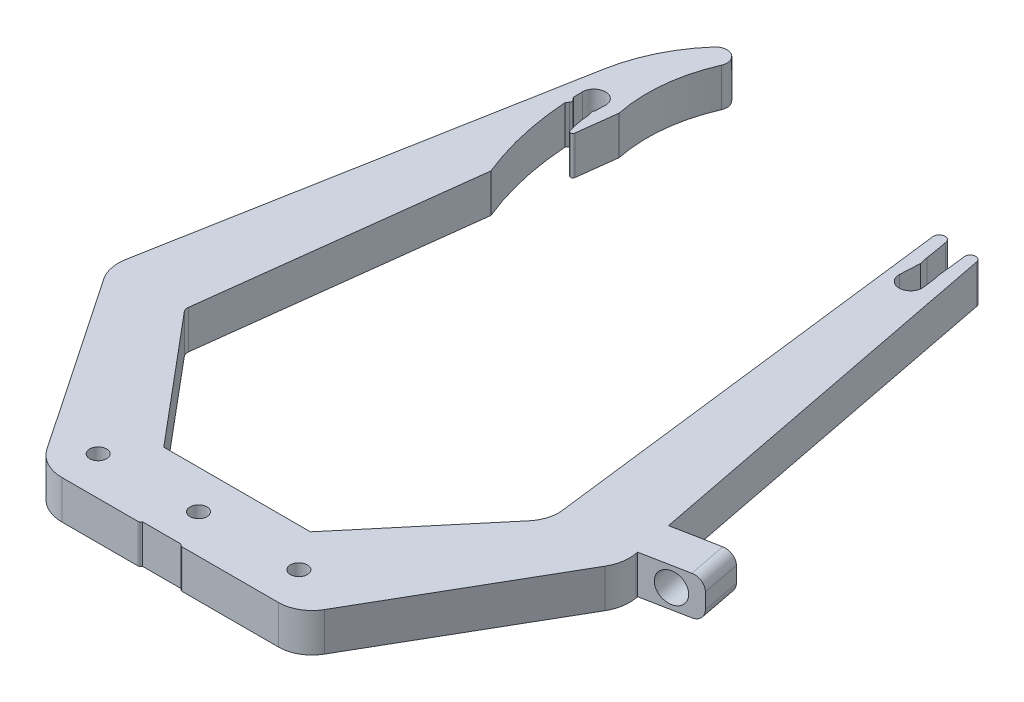
from build123d import *

# Parameters (mm, degrees)
EXTRUDE_1_DEPTH     = 10
CUT_EXTRUDE_1_REACH = 177.427
SKETCH_2_R          = 2.2
FILLET_1_R          = 0.6
SKETCH_3_W          = 10.144437824
SKETCH_3_H          = 10
EXTRUDE_2_DEPTH     = 15
CUT_EXTRUDE_2_REACH = 164.61
SKETCH_4_R          = 3.8
FILLET_2_R          = 3


with BuildPart() as part:
    # 草图1 → 凸台-拉伸1 (new body)
    with BuildSketch(Plane(origin=(0, 0, 0), x_dir=(1, 0, 0), z_dir=(0, 1, 0))):
        with BuildLine():
            Line((-19, 0), (19, 0))
            Line((19, 0), (44.854614973, 30.81233028))
            ThreePointArc((44.854614973, 30.81233028), (46.529317931, 33.929104052), (46.82231051, 37.455159084))
            Line((46.82231051, 37.455159084), (33.389549678, 146.856216784))
            ThreePointArc((33.389549678, 146.856216784), (34.753999407, 148.533855984), (36.376927445, 147.104765038))
            ThreePointArc((36.376927445, 147.104765038), (36.892496808, 144.296291333), (37.320815542, 141.473193853))
            Line((37.320815542, 141.473193853), (37.815132232, 139.258398169))
            ThreePointArc((37.815132232, 139.258398169), (37.817176658, 139.245056143), (37.817405692, 139.231560332))
            Line((37.817405692, 139.231560332), (37.557917484, 134.104765038))
            ThreePointArc((37.557917484, 134.104765038), (40.754926912, 130.959847465), (43.503129215, 134.503681536))
            Line((43.503129215, 134.503681536), (43.077003941, 137.813685213))
            Line((43.077003941, 137.813685213), (42.807637334, 138.925557366))
            ThreePointArc((42.807637334, 138.925557366), (42.806315787, 138.931905108), (42.80540838, 138.938325149))
            Line((42.80540838, 138.938325149), (42.129277547, 145.175318139))
            Line((42.129277547, 145.175318139), (41.965181023, 146.44996701))
            ThreePointArc((41.965181023, 146.44996701), (43.130662006, 148.010841711), (44.727999785, 146.895858405))
            Line((44.727999785, 146.895858405), (66.016482503, 37.376109146))
            ThreePointArc((66.016482503, 37.376109146), (66.063066684, 33.817543133), (64.860464706, 30.468019192))
            Line((64.860464706, 30.468019192), (38.23055697, -15.656334008))
            ThreePointArc((38.23055697, -15.656334008), (35.050772773, -18.836118205), (30.707106781, -20))
            Line((30.707106781, -20), (5.707106781, -20))
            ThreePointArc((5.707106781, -20), (5.515765065, -19.961939766), (5.353553391, -19.853553391))
            Line((5.353553391, -19.853553391), (5, -19.5))
            Line((5, -19.5), (-5, -19.5))
            Line((-5, -19.5), (-5.353553391, -19.853553391))
            ThreePointArc((-5.353553391, -19.853553391), (-5.515765065, -19.961939766), (-5.707106781, -20))
            Line((-5.707106781, -20), (-25.399802658, -20))
            ThreePointArc((-25.399802658, -20), (-30.087775174, -18.833058003), (-33.681629288, -15.604582738))
            Line((-33.681629288, -15.604582738), (-64.860464706, 30.468019192))
            ThreePointArc((-64.860464706, 30.468019192), (-66.063066684, 33.817543133), (-66.016482503, 37.376109146))
            Line((-66.016482503, 37.376109146), (-46.829620455, 141.890886738))
            ThreePointArc((-46.829620455, 141.890886738), (-43.465252598, 152.148967586), (-37.480163066, 161.13372674))
            ThreePointArc((-37.480163066, 161.13372674), (-33.620696298, 161.680216975), (-32.479267504, 157.953116813))
            ThreePointArc((-32.479267504, 157.953116813), (-35.579400499, 146.14570295), (-34.973851142, 133.953116813))
            Line((-34.973851142, 133.953116813), (-47.176674229, 34.569098196))
            ThreePointArc((-47.176674229, 34.569098196), (-47.109221395, 33.75732882), (-46.723670812, 33.03978429))
            Line((-46.723670812, 33.03978429), (-19, 0))
        make_face()
    extrude(amount=EXTRUDE_1_DEPTH)

    # 草图2 → 切除-拉伸1 (cut, up to next)
    with BuildSketch(Plane(origin=(0, 10, 0), x_dir=(1, 0, 0), z_dir=(0, 1, 0)), mode=Mode.PRIVATE) as cut_extrude_1_sk1:
        with Locations(Location((0, -10, 0), (0, 0, 270))):
            Circle(SKETCH_2_R)
    cut_extrude_1_tool1 = extrude(cut_extrude_1_sk1.sketch, amount=-CUT_EXTRUDE_1_REACH, mode=Mode.PRIVATE) & part.part
    # 草图2 → 切除-拉伸1 (cut, up to next)
    with BuildSketch(Plane(origin=(0, 10, 0), x_dir=(1, 0, 0), z_dir=(0, 1, 0)), mode=Mode.PRIVATE) as cut_extrude_1_sk2:
        with Locations(Location((-26, -10, 0), (0, 0, 270))):
            Circle(SKETCH_2_R)
    cut_extrude_1_tool2 = extrude(cut_extrude_1_sk2.sketch, amount=-CUT_EXTRUDE_1_REACH, mode=Mode.PRIVATE) & part.part
    # 草图2 → 切除-拉伸1 (cut, up to next)
    with BuildSketch(Plane(origin=(0, 10, 0), x_dir=(1, 0, 0), z_dir=(0, 1, 0)), mode=Mode.PRIVATE) as cut_extrude_1_sk3:
        with Locations(Location((26, -10, 0), (0, 0, 270))):
            Circle(SKETCH_2_R)
    cut_extrude_1_tool3 = extrude(cut_extrude_1_sk3.sketch, amount=-CUT_EXTRUDE_1_REACH, mode=Mode.PRIVATE) & part.part
    # 草图2 → 切除-拉伸1 (cut, up to next)
    with BuildSketch(Plane(origin=(0, 10, 0), x_dir=(1, 0, 0), z_dir=(0, 1, 0)), mode=Mode.PRIVATE) as cut_extrude_1_sk4:
        with BuildLine():
            Line((-36.549558395, 121.120011078), (-38.607748185, 104.35740041))
            ThreePointArc((-38.607748185, 104.35740041), (-42.47341142, 116.594845153), (-44.332546284, 129.292956179))
            Line((-44.332546284, 129.292956179), (-43.845113062, 129.987442667))
            ThreePointArc((-43.845113062, 129.987442667), (-43.702378092, 130.509625408), (-43.924830211, 131.003146575))
            Line((-43.924830211, 131.003146575), (-44.447419993, 131.543571067))
            ThreePointArc((-44.447419993, 131.543571067), (-44.482588605, 132.737575539), (-44.499925482, 133.931972015))
            ThreePointArc((-44.499925482, 133.931972015), (-41.418283025, 136.952003662), (-38.505677682, 133.768634142))
            ThreePointArc((-38.505677682, 133.768634142), (-38.556072369, 132.542586282), (-38.556286633, 131.315503182))
            Line((-38.556286633, 131.315503182), (-38.546052546, 131.325051295))
            ThreePointArc((-38.546052546, 131.325051295), (-38.780683801, 130.91622187), (-38.744387532, 130.446247504))
            Line((-38.744387532, 130.446247504), (-38.486748585, 129.793872308))
            ThreePointArc((-38.486748585, 129.793872308), (-37.841140795, 125.384806825), (-36.549558395, 121.120011078))
        make_face()
    cut_extrude_1_tool4 = extrude(cut_extrude_1_sk4.sketch, amount=-CUT_EXTRUDE_1_REACH, mode=Mode.PRIVATE) & part.part
    add(cut_extrude_1_tool1.solids().sort_by_distance((0, 10, 10))[0], mode=Mode.SUBTRACT)
    add(cut_extrude_1_tool2.solids().sort_by_distance((-26, 10, 10))[0], mode=Mode.SUBTRACT)
    add(cut_extrude_1_tool3.solids().sort_by_distance((26, 10, 10))[0], mode=Mode.SUBTRACT)
    add(cut_extrude_1_tool4.solids().sort_by_distance((-40.502089, 10, -123.156617))[0], mode=Mode.SUBTRACT)

    # 圆角1
    fillet_1_edges = [part.edges().sort_by_distance(p)[0] for p in [
        (-36.549558395, 5, -121.120011078),
        (-34.973851142, 5, -133.953116813),
    ]]
    fillet(fillet_1_edges, radius=FILLET_1_R)

    # 草图3 → 凸台-拉伸2 (add)
    with BuildSketch(Plane(origin=(70.613618069, 0, -13.725896909), x_dir=(-0.19080899537654988, 0, -0.9816271834476631), z_dir=(0.9816271834476631, 0, -0.19080899537654988))):
        with Locations((29.616052291, 5)):
            Rectangle(SKETCH_3_W, SKETCH_3_H)
    extrude(amount=EXTRUDE_2_DEPTH)

    # 草图4 → 切除-拉伸2 (cut, up to next)
    with BuildSketch(Plane(origin=(-4.68318419, 0, -24.092894031), x_dir=(0.981627183447663, 0, -0.19080899537654997), z_dir=(0.19080899537654997, 0, 0.981627183447663)), mode=Mode.PRIVATE) as cut_extrude_2_sk1:
        with Locations((79.435271618, 5)):
            Circle(SKETCH_4_R)
    cut_extrude_2_tool1 = extrude(cut_extrude_2_sk1.sketch, amount=-CUT_EXTRUDE_2_REACH, mode=Mode.PRIVATE) & part.part
    add(cut_extrude_2_tool1.solids().sort_by_distance((73.292638, 5, -39.249858))[0], mode=Mode.SUBTRACT)

    # 圆角2
    fillet_2_edges = [part.edges().sort_by_distance(p)[0] for p in [
        (79.687016636, 0, -45.659953836),
        (79.687016636, 10, -45.659953836),
    ]]
    fillet(fillet_2_edges, radius=FILLET_2_R)


solid = part.part
